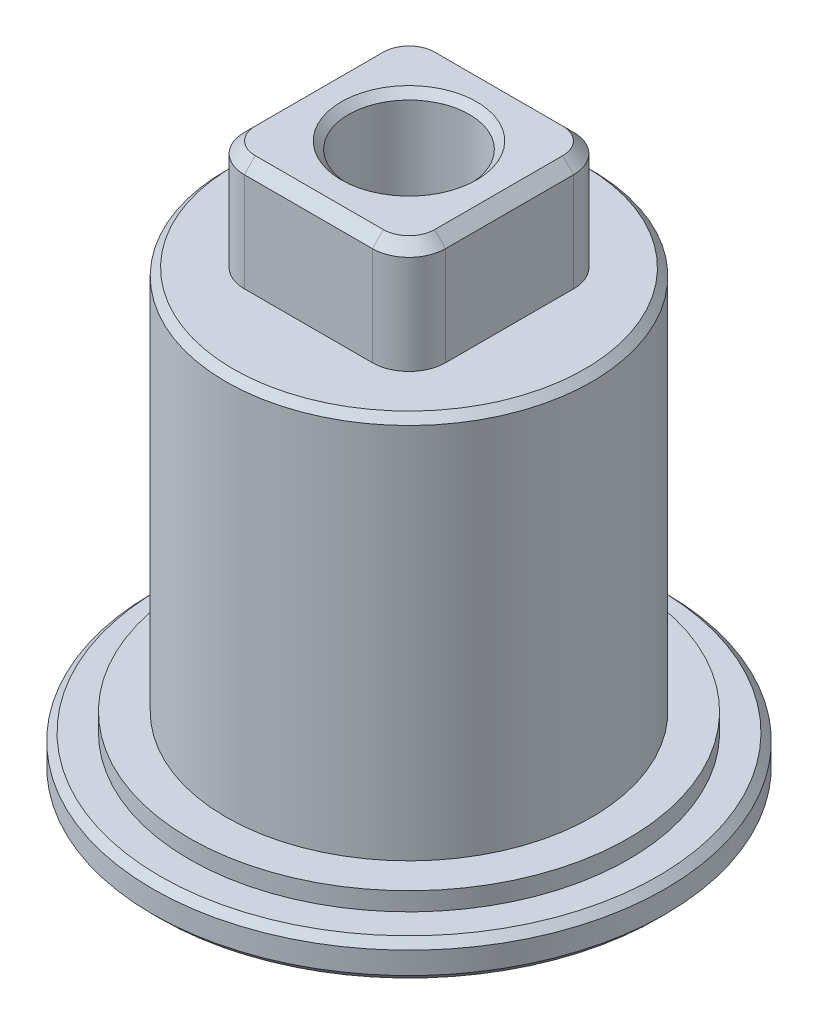
from build123d import *

# Parameters (mm, degrees)
SKETCH_1_R          = 7
SKETCH_1_R_2        = 1.65
EXTRUDE_1_DEPTH     = 1
SKETCH_1_4_R        = 6
SKETCH_1_4_R_2      = 1.65
EXTRUDE_2_DEPTH     = 1.5
SKETCH_1_5_R        = 5
SKETCH_1_5_R_2      = 1.65
EXTRUDE_3_DEPTH     = 12
EXTRUDE_START       = 2
SKETCH_1_6_R        = 4.25
SKETCH_1_6_W        = 5.5
SKETCH_1_6_H        = 5.5
EXTRUDE_4_DEPTH     = 10
SKETCH_1_7_W        = 5.5
SKETCH_1_7_H        = 5.5
SKETCH_1_7_R        = 1.65
EXTRUDE_5_DEPTH     = 13
SKETCH_1_8_R        = 1.65
EXTRUDE_6_DEPTH     = 2
CUT_EXTRUDE_1_DEPTH = 2
FILLET_1_R          = 1
CHAMFER_1_SIZE      = 0.2
CHAMFER_2_SIZE      = 0.3


with BuildPart() as part:
    # 스케치1 → 보스-돌출1 (new body)
    with BuildSketch(Plane(origin=(0, 0, 0), x_dir=(1, 0, 0), z_dir=(0, 1, 0))):
        Circle(SKETCH_1_R)
        Circle(SKETCH_1_R_2, mode=Mode.SUBTRACT)
    extrude(amount=EXTRUDE_1_DEPTH)

    # 스케치1<4> → 보스-돌출2 (add)
    with BuildSketch(Plane(origin=(0, 0, 0), x_dir=(1, 0, 0), z_dir=(0, 1, 0))):
        Circle(SKETCH_1_4_R)
        Circle(SKETCH_1_4_R_2, mode=Mode.SUBTRACT)
    extrude(amount=EXTRUDE_2_DEPTH)

    # 스케치1<5> → 보스-돌출3 (add)
    with BuildSketch(Plane(origin=(0, 0, 0), x_dir=(1, 0, 0), z_dir=(0, 1, 0))):
        Circle(SKETCH_1_5_R)
        Circle(SKETCH_1_5_R_2, mode=Mode.SUBTRACT)
    extrude(amount=EXTRUDE_3_DEPTH)

    # 스케치1<6> → 보스-돌출4 (add)
    with BuildSketch(Plane(origin=(0, 0, 0), x_dir=(1, 0, 0), z_dir=(0, 1, 0)).offset(EXTRUDE_START)):
        Circle(SKETCH_1_6_R)
        Rectangle(SKETCH_1_6_W, SKETCH_1_6_H, mode=Mode.SUBTRACT)
    extrude(amount=EXTRUDE_4_DEPTH)

    # 스케치1<7> → 보스-돌출5 (add)
    with BuildSketch(Plane(origin=(0, 0, 0), x_dir=(1, 0, 0), z_dir=(0, 1, 0)).offset(EXTRUDE_START)):
        Rectangle(SKETCH_1_7_W, SKETCH_1_7_H)
        Circle(SKETCH_1_7_R, mode=Mode.SUBTRACT)
    extrude(amount=EXTRUDE_5_DEPTH)

    # 스케치1<8> → 보스-돌출6 (add)
    with BuildSketch(Plane(origin=(0, 0, 0), x_dir=(1, 0, 0), z_dir=(0, 1, 0))):
        Circle(SKETCH_1_8_R)
    extrude(amount=EXTRUDE_6_DEPTH)

    # 스케치2 → 컷-돌출1 (cut)
    with BuildSketch(Plane.XZ):
        with BuildLine():
            ThreePointArc((-1, -3), (0, -4), (1, -3))
            Line((1, -3), (1, 3))
            ThreePointArc((1, 3), (0, 4), (-1, 3))
            Line((-1, 3), (-1, -3))
        make_face()
    extrude(amount=-CUT_EXTRUDE_1_DEPTH, mode=Mode.SUBTRACT)

    # 필렛1
    fillet_1_edges = [part.edges().sort_by_distance(p)[0] for p in [
        (2.75, 13.5, 2.75),
        (2.75, 13.5, -2.75),
        (-2.75, 13.5, -2.75),
        (-2.75, 13.5, 2.75),
    ]]
    fillet(fillet_1_edges, radius=FILLET_1_R)

    # 모따기1
    chamfer_1_edges = [part.edges().sort_by_distance(p)[0] for p in [
        (-5, 12, 0),
        (-7, 1, 0),
        (-7, 0, 0),
        (-1.65, 15, 0),
    ]]
    chamfer(chamfer_1_edges, length=CHAMFER_1_SIZE)

    # 모따기2
    chamfer_2_edges = [part.edges().sort_by_distance(p)[0] for p in [
        (2.75, 15, 0),
        (0, 15, 2.75),
        (-2.75, 15, 0),
        (0, 15, -2.75),
        (-2.457106781, 15, 2.457106781),
        (2.457106781, 15, 2.457106781),
        (-2.457106781, 15, -2.457106781),
        (2.457106781, 15, -2.457106781),
    ]]
    chamfer(chamfer_2_edges, length=CHAMFER_2_SIZE)

    # 스케치3 → 컷-회전1 (revolve, cut)
    with BuildSketch(Plane(origin=(0, 0, 0), x_dir=(0, 0, -1), z_dir=(1, 0, 0))):
        Polygon((0, 1.316547622), (0, 2), (-1.65, 2), align=None)
    revolve(axis=Axis((0, 11.8, 0), (0, -1, 0)), mode=Mode.SUBTRACT)


solid = part.part
